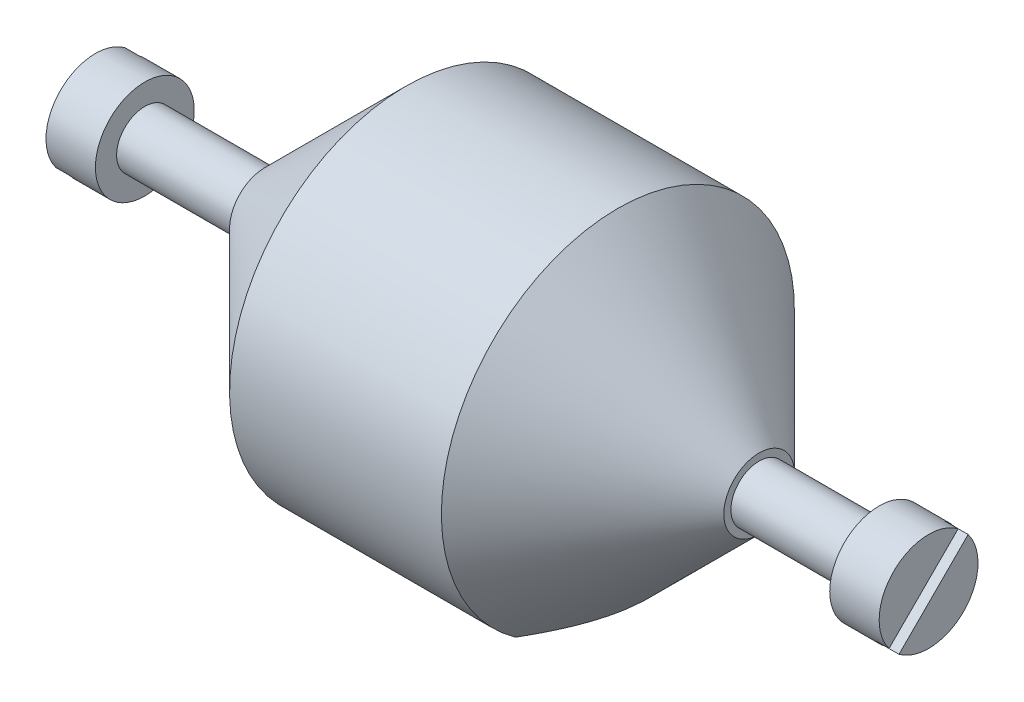
from build123d import *

# Parameters (mm, degrees)
SKETCH1_R           = 12.5
BOSS_EXTRUDE1_DEPTH = 17.5
SKETCH2_R           = 2
BOSS_EXTRUDE2_DEPTH = 26
CHAMFER1_SIZE       = 10
SKETCH3_W           = 28.997372317
SKETCH3_H           = 7.197339184
CUT_EXTRUDE1_DEPTH  = 20
SKETCH4_R           = 5
CUT_EXTRUDE2_DEPTH  = 5
SKETCH5_R           = 3.5
BOSS_EXTRUDE3_DEPTH = 3.5
CUT_EXTRUDE6_START  = -1
CUT_EXTRUDE6_DEPTH  = 1


with BuildPart() as part:
    # Sketch1 → Boss-Extrude1 (new, symmetric)
    with BuildSketch(Plane(origin=(0, 0, 0), x_dir=(0, 0, -1), z_dir=(1, 0, 0))):
        Circle(SKETCH1_R)
    extrude(amount=BOSS_EXTRUDE1_DEPTH, both=True)

    # Sketch2 → Boss-Extrude2 (add, symmetric)
    with BuildSketch(Plane(origin=(0, 0, 0), x_dir=(0, 0, -1), z_dir=(1, 0, 0))):
        with Locations(Location((0, 0, 0), (0, 0, 180))):
            Circle(SKETCH2_R)
    extrude(amount=BOSS_EXTRUDE2_DEPTH, both=True)

    # Chamfer1
    chamfer1_edges = [part.edges().sort_by_distance(p)[0] for p in [
        (-17.5, 0, 12.5),
        (17.5, 0, 12.5),
    ]]
    chamfer(chamfer1_edges, length=CHAMFER1_SIZE)

    # Sketch3 → Cut-Extrude1 (cut, symmetric)
    with BuildSketch(Plane(origin=(0, 0, 0), x_dir=(0, 0, -1), z_dir=(1, 0, 0))):
        with Locations((0.644848308, -13.770631617)):
            Rectangle(SKETCH3_W, SKETCH3_H)
    extrude(amount=CUT_EXTRUDE1_DEPTH, both=True, mode=Mode.SUBTRACT)

    # Sketch4 → Cut-Extrude2 (cut)
    with BuildSketch(Plane.XZ.offset(10.171962025)):
        with Locations(Location((0, 0, 0), (0, 0, 270))):
            Circle(SKETCH4_R)
    extrude(amount=-CUT_EXTRUDE2_DEPTH, mode=Mode.SUBTRACT)

    # Sketch5 → Boss-Extrude3 (add)
    with BuildSketch(Plane.ZY.offset(26)):
        Circle(SKETCH5_R)
    boss_extrude3 = extrude(amount=BOSS_EXTRUDE3_DEPTH)

    # Sketch6 → Cut-Extrude6 (cut)
    with BuildSketch(Plane.ZY.offset(29.5).offset(CUT_EXTRUDE6_START)):
        with BuildLine():
            Line((2.803043133, -2.095936352), (-2.095936352, 2.803043133))
            ThreePointArc((-2.095936352, 2.803043133), (-2.474873734, 2.474873734), (-2.803043133, 2.095936352))
            Line((-2.803043133, 2.095936352), (2.095936352, -2.803043133))
            ThreePointArc((2.095936352, -2.803043133), (2.474873734, -2.474873734), (2.803043133, -2.095936352))
        make_face()
    cut_extrude6 = extrude(amount=CUT_EXTRUDE6_DEPTH, mode=Mode.SUBTRACT)

    # Mirror1: Boss-Extrude3, Cut-Extrude6 across plane
    add(boss_extrude3.mirror(Plane(origin=(0, 0, 0), x_dir=(0, 0, 1), z_dir=(1, 0, 0))))
    add(cut_extrude6.mirror(Plane(origin=(0, 0, 0), x_dir=(0, 0, 1), z_dir=(1, 0, 0))), mode=Mode.SUBTRACT)


solid = part.part
